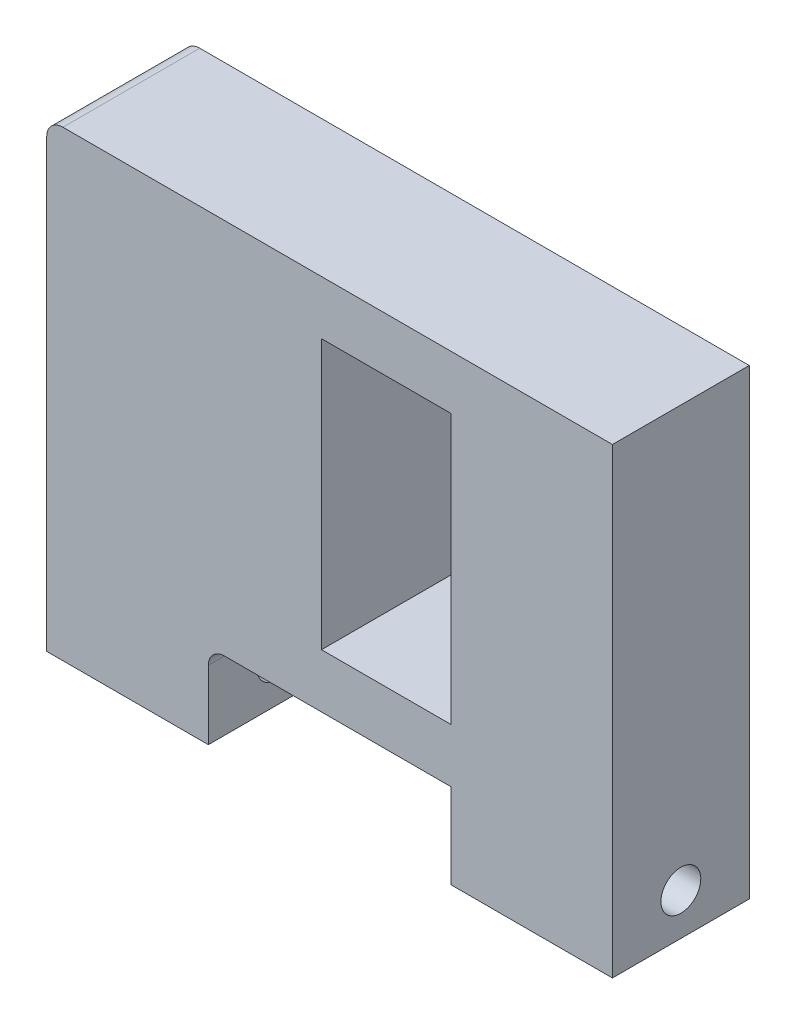
from build123d import *

# Parameters (mm, degrees)
BOSS_EXTRUDE1_DEPTH = 12.7
FILLET1_R           = 1.5
FILLET2_R           = 1.5
SKETCH4_R           = 1.85
CUT_EXTRUDE1_DEPTH  = 63.498108771
SKETCH11_W          = 12
SKETCH11_H          = 25
CUT_EXTRUDE2_DEPTH  = 12.7


with BuildPart() as part:
    # Sketch1 → Boss-Extrude1 (new body)
    with BuildSketch(Plane.XY):
        Polygon((11.25, -11.44), (26.25, -11.44), (26.25, 31.44), (-26.25, 31.44), (-26.25, -11.44), (-11.25, -11.44), (-11.25, -3.56), (11.25, -3.56), align=None)
    extrude(amount=BOSS_EXTRUDE1_DEPTH)

    # Fillet1
    fillet1_edges = [part.edges().sort_by_distance(p)[0] for p in [
        (-26.25, 31.44, 6.35),
    ]]
    fillet(fillet1_edges, radius=FILLET1_R)

    # Fillet2
    fillet2_edges = [part.edges().sort_by_distance(p)[0] for p in [
        (-11.25, -3.56, 6.35),
    ]]
    fillet(fillet2_edges, radius=FILLET2_R)

    # Sketch4 → Cut-Extrude1 (cut, through all)
    with BuildSketch(Plane.ZY.offset(26.25)):
        with Locations(Location((6.35, -7.56, 0), (0, 0, 270))):
            Circle(SKETCH4_R)
    extrude(amount=-CUT_EXTRUDE1_DEPTH, mode=Mode.SUBTRACT)

    # Sketch11 → Cut-Extrude2 (cut)
    with BuildSketch(Plane.XY.offset(12.7)):
        with Locations((5.25, 13.945)):
            Rectangle(SKETCH11_W, SKETCH11_H)
    extrude(amount=-CUT_EXTRUDE2_DEPTH, mode=Mode.SUBTRACT)


solid = part.part
